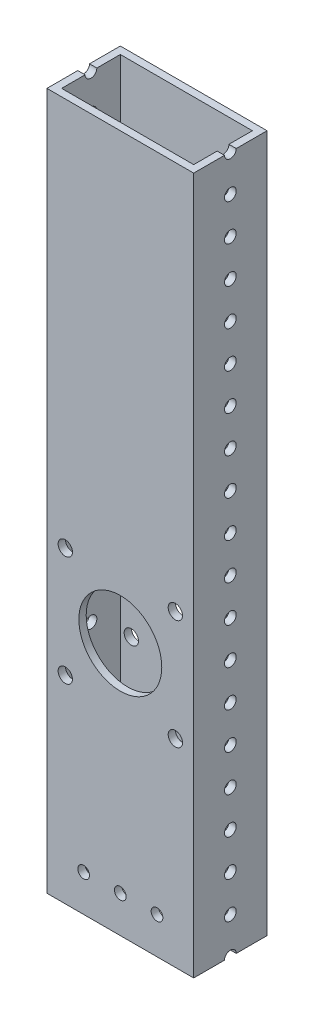
from build123d import *

# Parameters (mm, degrees)
SKETCH2_W           = 50.8
SKETCH2_H           = 25.4
SKETCH2_W_2         = 45.72
SKETCH2_H_2         = 20.32
BOSS_EXTRUDE1_DEPTH = 635
SKETCH3_R           = 2.032
CUT_EXTRUDE1_DEPTH  = 638.155342126
SKETCH4_R           = 2.032
CUT_EXTRUDE2_DEPTH  = 637.015188498
SKETCH5_R           = 14.351
SKETCH5_R_2         = 2.479261189
CUT_EXTRUDE3_DEPTH  = 637.015188498
SKETCH6_W           = 50.8
SKETCH6_H           = 25.4
CUT_EXTRUDE4_DEPTH  = 355.6
SKETCH12_W          = 50.8
SKETCH12_H          = 25.4
CUT_EXTRUDE9_DEPTH  = 38.1


with BuildPart() as part:
    # Sketch2 → Boss-Extrude1 (new body)
    with BuildSketch(Plane(origin=(0, 0, 0), x_dir=(1, 0, 0), z_dir=(0, 1, 0))):
        Rectangle(SKETCH2_W, SKETCH2_H)
        Rectangle(SKETCH2_W_2, SKETCH2_H_2, mode=Mode.SUBTRACT)
    extrude(amount=BOSS_EXTRUDE1_DEPTH)

    # Sketch3 → Cut-Extrude1 (cut, through all)
    with BuildSketch(Plane(origin=(25.4, 0, 0), x_dir=(0, 0, -1), z_dir=(1, 0, 0))):
        Circle(SKETCH3_R)
        with Locations((0, 12.7)):
            Circle(SKETCH3_R)
        with Locations((0, 25.4)):
            Circle(SKETCH3_R)
        with Locations((0, 38.1)):
            Circle(SKETCH3_R)
        with Locations((0, 50.8)):
            Circle(SKETCH3_R)
        with Locations((0, 63.5)):
            Circle(SKETCH3_R)
        with Locations((0, 76.2)):
            Circle(SKETCH3_R)
        with Locations((0, 88.9)):
            Circle(SKETCH3_R)
        with Locations((0, 101.6)):
            Circle(SKETCH3_R)
        with Locations((0, 114.3)):
            Circle(SKETCH3_R)
        with Locations((0, 127)):
            Circle(SKETCH3_R)
        with Locations((0, 139.7)):
            Circle(SKETCH3_R)
        with Locations((0, 152.4)):
            Circle(SKETCH3_R)
        with Locations((0, 165.1)):
            Circle(SKETCH3_R)
        with Locations((0, 177.8)):
            Circle(SKETCH3_R)
        with Locations((0, 190.5)):
            Circle(SKETCH3_R)
        with Locations((0, 203.2)):
            Circle(SKETCH3_R)
        with Locations((0, 215.9)):
            Circle(SKETCH3_R)
        with Locations((0, 228.6)):
            Circle(SKETCH3_R)
        with Locations((0, 241.3)):
            Circle(SKETCH3_R)
        with Locations((0, 254)):
            Circle(SKETCH3_R)
        with Locations((0, 266.7)):
            Circle(SKETCH3_R)
        with Locations((0, 279.4)):
            Circle(SKETCH3_R)
        with Locations((0, 292.1)):
            Circle(SKETCH3_R)
        with Locations((0, 304.8)):
            Circle(SKETCH3_R)
        with Locations((0, 317.5)):
            Circle(SKETCH3_R)
        with Locations((0, 330.2)):
            Circle(SKETCH3_R)
        with Locations((0, 342.9)):
            Circle(SKETCH3_R)
        with Locations((0, 355.6)):
            Circle(SKETCH3_R)
        with Locations((0, 368.3)):
            Circle(SKETCH3_R)
        with Locations((0, 381)):
            Circle(SKETCH3_R)
        with Locations((0, 393.7)):
            Circle(SKETCH3_R)
        with Locations((0, 406.4)):
            Circle(SKETCH3_R)
        with Locations((0, 419.1)):
            Circle(SKETCH3_R)
        with Locations((0, 431.8)):
            Circle(SKETCH3_R)
        with Locations((0, 444.5)):
            Circle(SKETCH3_R)
        with Locations((0, 457.2)):
            Circle(SKETCH3_R)
        with Locations((0, 469.9)):
            Circle(SKETCH3_R)
        with Locations((0, 482.6)):
            Circle(SKETCH3_R)
        with Locations((0, 495.3)):
            Circle(SKETCH3_R)
        with Locations((0, 508)):
            Circle(SKETCH3_R)
        with Locations((0, 520.7)):
            Circle(SKETCH3_R)
        with Locations((0, 533.4)):
            Circle(SKETCH3_R)
        with Locations((0, 546.1)):
            Circle(SKETCH3_R)
        with Locations((0, 558.8)):
            Circle(SKETCH3_R)
        with Locations((0, 571.5)):
            Circle(SKETCH3_R)
        with Locations((0, 584.2)):
            Circle(SKETCH3_R)
        with Locations((0, 596.9)):
            Circle(SKETCH3_R)
        with Locations((0, 609.6)):
            Circle(SKETCH3_R)
        with Locations((0, 622.3)):
            Circle(SKETCH3_R)
    extrude(amount=-CUT_EXTRUDE1_DEPTH, mode=Mode.SUBTRACT)

    # Sketch4 → Cut-Extrude2 (cut, through all)
    with BuildSketch(Plane.XY.offset(12.7)):
        with Locations((-12.7, 12.7)):
            Circle(SKETCH4_R)
        with Locations((0, 12.7)):
            Circle(SKETCH4_R)
        with Locations((12.7, 12.7)):
            Circle(SKETCH4_R)
    extrude(amount=-CUT_EXTRUDE2_DEPTH, mode=Mode.SUBTRACT)

    # Sketch5 → Cut-Extrude3 (cut, through all)
    with BuildSketch(Plane.XY.offset(12.7)):
        with Locations((0, 87.63)):
            Circle(SKETCH5_R)
        with Locations((-19.05, 106.68)):
            Circle(SKETCH5_R_2)
        with Locations((19.05, 106.68)):
            Circle(SKETCH5_R_2)
        with Locations((19.05, 68.58)):
            Circle(SKETCH5_R_2)
        with Locations((-19.05, 68.58)):
            Circle(SKETCH5_R_2)
    extrude(amount=-CUT_EXTRUDE3_DEPTH, mode=Mode.SUBTRACT)

    # Sketch6 → Cut-Extrude4 (cut)
    with BuildSketch(Plane(origin=(0, 635, 0), x_dir=(1, 0, 0), z_dir=(0, 1, 0))):
        Rectangle(SKETCH6_W, SKETCH6_H)
    extrude(amount=-CUT_EXTRUDE4_DEPTH, mode=Mode.SUBTRACT)

    # Sketch12 → Cut-Extrude9 (cut)
    with BuildSketch(Plane(origin=(0, 279.4, 0), x_dir=(1, 0, 0), z_dir=(0, 1, 0))):
        Rectangle(SKETCH12_W, SKETCH12_H)
    extrude(amount=-CUT_EXTRUDE9_DEPTH, mode=Mode.SUBTRACT)


solid = part.part
